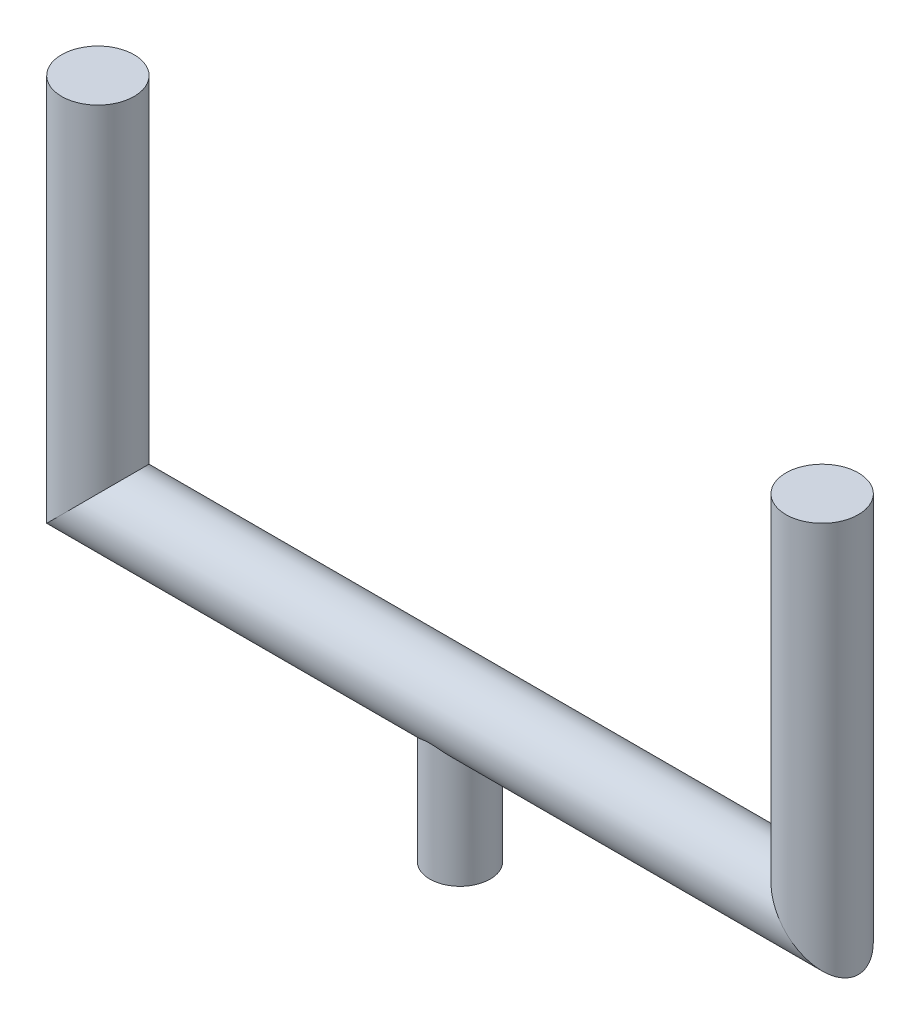
from build123d import *

# Parameters (mm, degrees)
SKETCH_1_R      = 3
SKETCH_4_R      = 2.5
EXTRUDE_1_DEPTH = 11.25


with BuildPart() as part:
    # 扫描1: sweep along a path in 草图2
    with BuildLine(Plane.XY) as sweep_1_path:
        Line((0, 0), (0, -30))
        Line((0, -30), (60, -30))
        Line((60, -30), (60, 0))
    # 草图1 → 扫描1 (sweep)
    with BuildSketch(Plane(origin=(0, 0, 0), x_dir=(1, 0, 0), z_dir=(0, 1, 0))):
        Circle(SKETCH_1_R)
    sweep(path=sweep_1_path.line, transition=Transition.RIGHT)

    # 草图4 → 凸台-拉伸1 (add)
    with BuildSketch(Plane(origin=(30, -30.150206029, 1.8381e-05), x_dir=(1, 0, 0), z_dir=(0, 1, 0))):
        Circle(SKETCH_4_R)
    extrude(amount=-EXTRUDE_1_DEPTH)


solid = part.part
